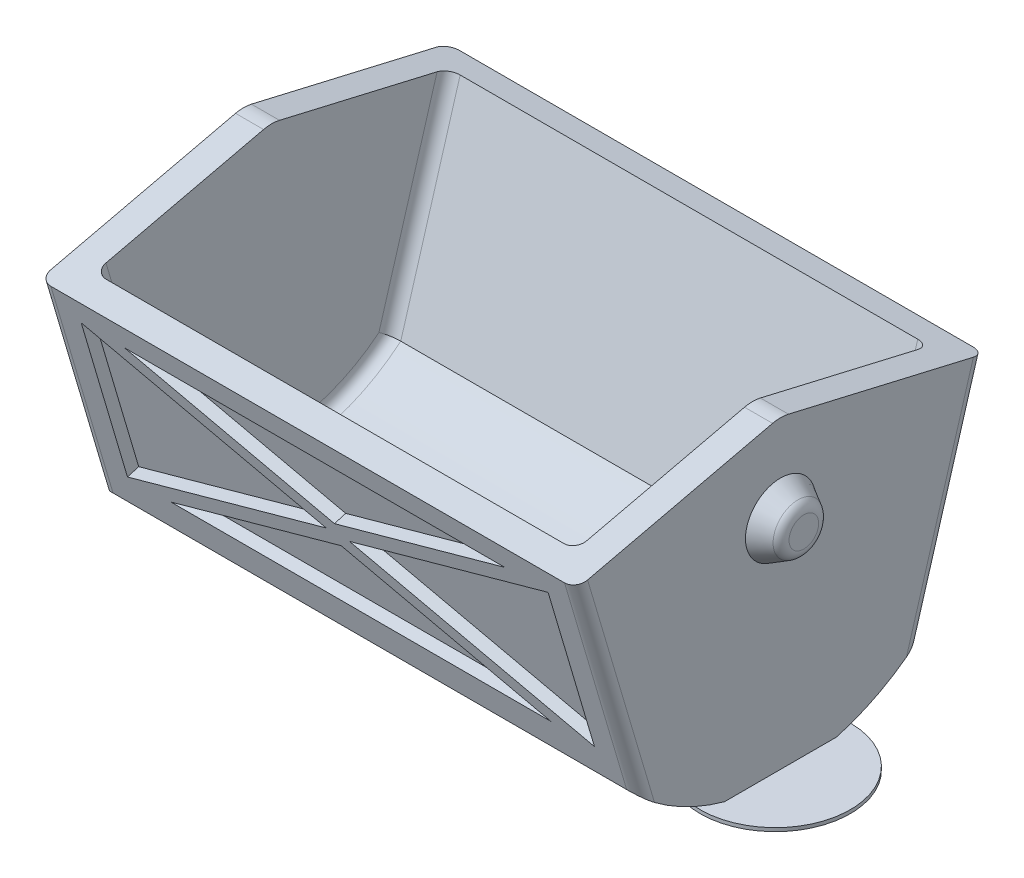
from build123d import *

# Parameters (mm, degrees)
BOSS_EXTRUDE1_DEPTH = 23
SHELL1_T            = -2.4
BOSS_EXTRUDE2_START = 23
SKETCH2_R           = 3
BOSS_EXTRUDE2_DEPTH = 2
BOSS_EXTRUDE2_TAPER = 30
BOSS_EXTRUDE3_START = -23
SKETCH2_2_R         = 3
BOSS_EXTRUDE3_DEPTH = 2
BOSS_EXTRUDE3_DRAFT = -30
FILLET1_R           = 1
CUT_EXTRUDE1_DEPTH  = 1
SKETCH4_W           = 40.50345243
SKETCH4_H           = 8.465012935
CUT_EXTRUDE2_DEPTH  = 50
BOSS_EXTRUDE4_START = -13.918462
SKETCH5_R           = 6.429553597
BOSS_EXTRUDE4_DEPTH = 0.3
FILLET2_R           = 1


with BuildPart() as part:
    # Sketch1 → Boss-Extrude1 (new, symmetric)
    with BuildSketch(Plane(origin=(0, 0, 0), x_dir=(0, 0, -1), z_dir=(1, 0, 0))):
        with BuildLine():
            Line((-12.176285942, -9.526430091), (-17.5, 8.473569909))
            Line((-17.5, 8.473569909), (-0.681235958, 12.395199175))
            ThreePointArc((-0.681235958, 12.395199175), (0, 12.473569909), (0.681235958, 12.395199175))
            Line((0.681235958, 12.395199175), (17.5, 8.473569909))
            Line((17.5, 8.473569909), (12.176285942, -9.526430091))
            ThreePointArc((12.176285942, -9.526430091), (0, -14.269806816), (-12.176285942, -9.526430091))
        make_face()
    extrude(amount=BOSS_EXTRUDE1_DEPTH, both=True)

    # Shell1
    shell1_openings = [part.faces().sort_by_distance(p)[0] for p in [
        (0, 10.434384542, 9.090617979),
        (0, 12.473569909, 0),
        (0, 10.434384542, -9.090617979),
    ]]
    offset(amount=SHELL1_T, openings=shell1_openings, kind=Kind.INTERSECTION)

    # Sketch2 → Boss-Extrude2 (add)
    with BuildSketch(Plane(origin=(0, 0, 0), x_dir=(0, 0, -1), z_dir=(1, 0, 0)).offset(BOSS_EXTRUDE2_START)):
        with Locations((0, 5)):
            Circle(SKETCH2_R)
    extrude(amount=BOSS_EXTRUDE2_DEPTH, taper=BOSS_EXTRUDE2_TAPER)


with BuildPart() as boss_extrude3_tool:
    # Sketch2<2> → Boss-Extrude3 (with draft: the straight prism first)
    with BuildSketch(Plane(origin=(0, 0, 0), x_dir=(0, 0, -1), z_dir=(1, 0, 0)).offset(BOSS_EXTRUDE3_START)):
        with Locations((0, 5)):
            Circle(SKETCH2_2_R)
    extrude(amount=-BOSS_EXTRUDE3_DEPTH)
    # Boss-Extrude3: the draft: its side faces are tilted about the plane it starts from
    boss_extrude3_sides = [boss_extrude3_tool.faces().sort_by_distance(p)[0] for p in [
        (-24, 5, 3),
    ]]
    draft(boss_extrude3_sides, Plane(origin=(0, 0, 0), x_dir=(0, 0, -1), z_dir=(1, 0, 0)).offset(BOSS_EXTRUDE3_START), BOSS_EXTRUDE3_DRAFT)


with BuildPart() as part_1:
    add(part.part)

    # Boss-Extrude3: add boss_extrude3_tool
    add(boss_extrude3_tool.part)

    # Fillet1
    fillet1_edges = [part_1.edges().sort_by_distance(p)[0] for p in [
        (23, -0.526430091, 14.838142971),
        (-20.6, -11.869806816, 0),
        (-20.6, 0.417860611, -12.614658399),
        (-20.6, 0.417860611, 12.614658399),
        (20.6, -11.869806816, 0),
        (20.6, 0.417860611, -12.614658399),
        (20.6, 0.417860611, 12.614658399),
        (-23, -0.526430091, 14.838142971),
        (23, -0.526430091, -14.838142971),
        (-23, -0.526430091, -14.838142971),
    ]]
    fillet(fillet1_edges, radius=FILLET1_R)

    # Sketch3 → Cut-Extrude1 (cut)
    with BuildSketch(Plane(origin=(0, -99.309611189, -14.378157577), x_dir=(1, 0, 0), z_dir=(0, 0.28361719382763534, -0.9589375826222152))):
        Polygon((-20, -96.309611189), (-1, -103.309611189), (-20, -110.309611189), align=None)
        Polygon((20, -110.309611189), (20, -96.309611189), (1, -103.309611189), align=None)
        Polygon((-16.285714286, -96.309611189), (16.285714286, -96.309611189), (0, -102.309611189), align=None)
        Polygon((-16.285714286, -110.309611189), (16.285714286, -110.309611189), (0, -104.309611189), align=None)
    cut_extrude1 = extrude(amount=CUT_EXTRUDE1_DEPTH, mode=Mode.SUBTRACT)

    # Mirror1: Cut-Extrude1 across plane
    add(cut_extrude1.mirror(Plane.XY), mode=Mode.SUBTRACT)

    # Sketch4 → Cut-Extrude2 (cut, symmetric)
    with BuildSketch(Plane(origin=(0, 0, 0), x_dir=(0, 0, -1), z_dir=(1, 0, 0))):
        with Locations((0, -18.150968344)):
            Rectangle(SKETCH4_W, SKETCH4_H)
    extrude(amount=CUT_EXTRUDE2_DEPTH, both=True, mode=Mode.SUBTRACT)

    # Sketch5 → Boss-Extrude4 (add)
    with BuildSketch(Plane(origin=(0, 0, 0), x_dir=(1, 0, 0), z_dir=(0, 1, 0)).offset(BOSS_EXTRUDE4_START)):
        with Locations((22.552407332, 0)):
            Circle(SKETCH5_R)
        with Locations((-22.552407332, 0)):
            Circle(SKETCH5_R)
    extrude(amount=BOSS_EXTRUDE4_DEPTH)

    # Fillet2
    fillet2_edges = [part_1.edges().sort_by_distance(p)[0] for p in [
        (25, 5, 1.845299462),
        (-25, 5, 1.845299462),
    ]]
    fillet(fillet2_edges, radius=FILLET2_R)


solid = part_1.part
